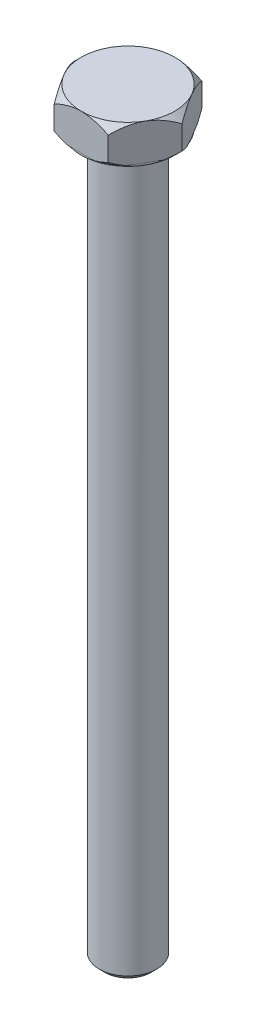
from build123d import *

# Parameters (mm, degrees)
BOSS_EXTRUDE1_DEPTH = 5.3
SKETCH2_OUTSIDE_W   = 21.122
SKETCH2_OUTSIDE_H   = 19.11
SKETCH2_OUTSIDE_R   = 6.5
CUT_EXTRUDE1_DEPTH  = 0.265
SKETCH3_R           = 4
BOSS_EXTRUDE2_DEPTH = 100
CHAMFER1_SIZE       = 0.8


with BuildPart() as part:
    # Sketch1 → Boss-Extrude1 (new body)
    with BuildSketch(Plane(origin=(0, 0, 0), x_dir=(1, 0, 0), z_dir=(0, 1, 0))):
        Polygon((7.505553499, 0), (3.75277675, 6.5), (-3.75277675, 6.5), (-7.505553499, 0), (-3.75277675, -6.5), (3.75277675, -6.5), align=None)
    extrude(amount=-BOSS_EXTRUDE1_DEPTH)

    # Sketch4 → Cut-Revolve1 (revolve, cut)
    with BuildSketch(Plane(origin=(0, 0, 0), x_dir=(0, 0, -1), z_dir=(1, 0, 0))):
        Polygon((-6.5, 0), (-8.15, 0), (-8.15, -1.65), align=None)
        Polygon((-8.15, -3.65), (-6.5, -5.3), (-8.15, -5.3), align=None)
    revolve(axis=Axis((0, 0, 0), (0, -1, 0)), mode=Mode.SUBTRACT)

    # Sketch2 outside → Cut-Extrude1 (cut)
    with BuildSketch(Plane.XZ.offset(5.3)):
        Rectangle(SKETCH2_OUTSIDE_W, SKETCH2_OUTSIDE_H)
        with Locations(Location((0, 0, 0), (0, 0, 90))):
            Circle(SKETCH2_OUTSIDE_R, mode=Mode.SUBTRACT)
    extrude(amount=-CUT_EXTRUDE1_DEPTH, mode=Mode.SUBTRACT)

    # Sketch3 → Boss-Extrude2 (add)
    with BuildSketch(Plane.XZ.offset(5.3)):
        with Locations(Location((0, 0, 0), (0, 0, 90))):
            Circle(SKETCH3_R)
    extrude(amount=BOSS_EXTRUDE2_DEPTH)

    # Chamfer1
    chamfer1_edges = [part.edges().sort_by_distance(p)[0] for p in [
        (0, -105.3, -4),
    ]]
    chamfer(chamfer1_edges, length=CHAMFER1_SIZE)


solid = part.part
